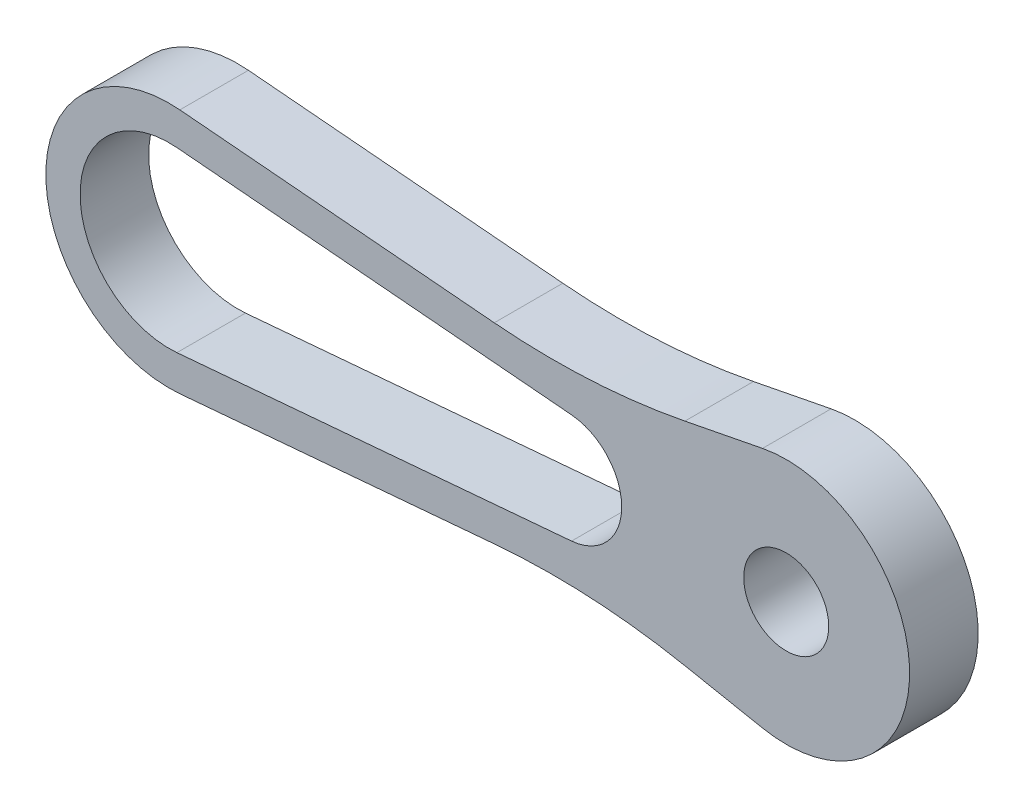
from build123d import *

# Parameters (mm, degrees)
TIJELO_DEPTH       = 5
UTOR_ZA_RUKU_DEPTH = 55.972720508
SKETCH8_R          = 3.1
CUT_EXTRUDE2_DEPTH = 10


with BuildPart() as part:
    # Sketch2 → Tijelo (new body)
    with BuildSketch(Plane.XY):
        with BuildLine():
            Line((0.775862069, 8.966495305), (23.705382946, 6.98242629))
            ThreePointArc((23.705382946, 6.98242629), (30.68412811, 6.867543469), (37.610875669, 7.725593798))
            Line((37.610875669, 7.725593798), (43.272873379, 8.832725153))
            ThreePointArc((43.272873379, 8.832725153), (54, 0), (43.272873379, -8.832725153))
            Line((43.272873379, -8.832725153), (37.610875669, -7.725593798))
            ThreePointArc((37.610875669, -7.725593798), (30.68412811, -6.867543469), (23.705382946, -6.98242629))
            Line((23.705382946, -6.98242629), (0.775862069, -8.966495305))
            ThreePointArc((0.775862069, -8.966495305), (-9, 0), (0.775862069, 8.966495305))
        make_face()
    extrude(amount=TIJELO_DEPTH)

    # Sketch1 → Utor za ruku (cut, through all)
    with BuildSketch(Plane.XY):
        with BuildLine():
            Line((0.560344828, 6.475802165), (29.344827586, 3.985109024))
            ThreePointArc((29.344827586, 3.985109024), (33, 0), (29.344827586, -3.985109024))
            Line((29.344827586, -3.985109024), (0.560344828, -6.475802165))
            ThreePointArc((0.560344828, -6.475802165), (-6.5, 0), (0.560344828, 6.475802165))
        make_face()
    extrude(amount=UTOR_ZA_RUKU_DEPTH, mode=Mode.SUBTRACT)

    # Sketch8 → Cut-Extrude2 (cut)
    with BuildSketch(Plane.XY):
        with Locations((45, 0)):
            Circle(SKETCH8_R)
    extrude(amount=CUT_EXTRUDE2_DEPTH, mode=Mode.SUBTRACT)


solid = part.part
